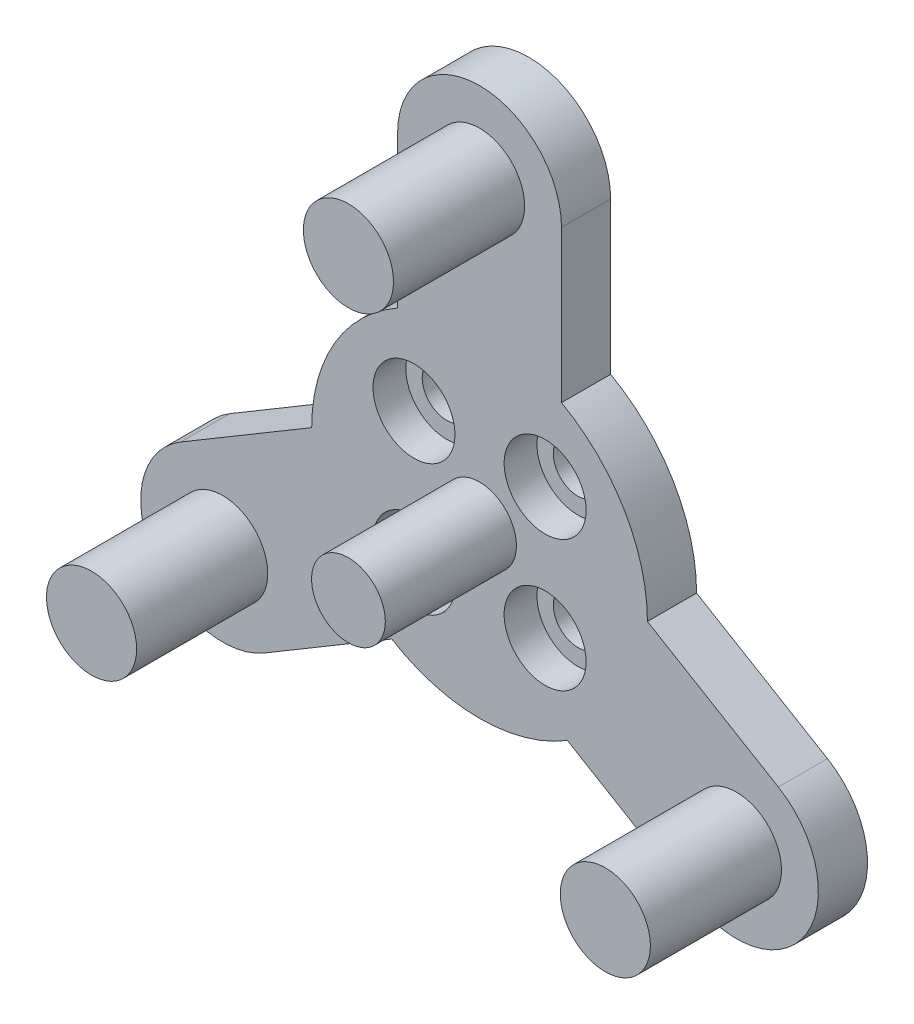
from build123d import *

# Parameters (mm, degrees)
SALIENTE_EXTRUIR1_DEPTH = 3
CROQUIS2_R              = 2.75
SALIENTE_EXTRUIR2_DEPTH = 8
CROQUIS3_R              = 2.25
SALIENTE_EXTRUIR3_DEPTH = 8
CORTAR_EXTRUIR1_DEPTH   = 10
CROQUIS5_R              = 2.5
CORTAR_EXTRUIR2_DEPTH   = 2


with BuildPart() as part:
    # Croquis1 → Saliente-Extruir1 (new body)
    with BuildSketch(Plane.XY):
        with BuildLine():
            Line((-13.118348224, -13.346885602), (-5.358962429, -8.729934305))
            ThreePointArc((-5.358962429, -8.729934305), (0, -10.243545836), (5.358962429, -8.729934305))
            Line((5.358962429, -8.729934305), (13.118348224, -13.346885602))
            ThreePointArc((13.118348224, -13.346885602), (19.97194541, -11.606711584), (18.231771393, -4.753114398))
            Line((18.231771393, -4.753114398), (10.243545836, 0))
            ThreePointArc((10.243545836, 0), (8.83594818, 5.182301714), (5, 8.94037087))
            Line((5, 8.94037087), (5, 18.2))
            ThreePointArc((5, 18.2), (0, 23.2), (-5, 18.2))
            Line((-5, 18.2), (-5, 8.94037087))
            ThreePointArc((-5, 8.94037087), (-8.83594818, 5.182301714), (-10.243545836, 0))
            Line((-10.243545836, 0), (-18.231771393, -4.753114398))
            ThreePointArc((-18.231771393, -4.753114398), (-19.97194541, -11.606711584), (-13.118348224, -13.346885602))
        make_face()
    extrude(amount=SALIENTE_EXTRUIR1_DEPTH)

    # Croquis2 → Saliente-Extruir2 (add)
    with BuildSketch(Plane.XY.offset(3)):
        with Locations((0, 18.2)):
            Circle(CROQUIS2_R)
        with Locations((15.675059808, -9.05)):
            Circle(CROQUIS2_R)
        with Locations((-15.675059808, -9.05)):
            Circle(CROQUIS2_R)
    extrude(amount=SALIENTE_EXTRUIR2_DEPTH)

    # Croquis3 → Saliente-Extruir3 (add)
    with BuildSketch(Plane.XY.offset(3)):
        Circle(CROQUIS3_R)
    extrude(amount=SALIENTE_EXTRUIR3_DEPTH)

    # Croquis4 → Cortar-Extruir1 (cut)
    with BuildSketch(Plane(origin=(0, 0, 0), x_dir=(-1, 0, 0), z_dir=(0, 0, -1))):
        with BuildLine():
            Line((-4, 2.5), (-4, 4))
            Line((-4, 4), (-2.5, 4))
            ThreePointArc((-2.5, 4), (-5.060660172, 5.060660172), (-4, 2.5))
        make_face()
        with BuildLine():
            Line((-2.5, 4), (-4, 4))
            Line((-4, 4), (-4, 2.5))
            ThreePointArc((-4, 2.5), (-2.939339828, 2.939339828), (-2.5, 4))
        make_face()
        with BuildLine():
            ThreePointArc((5.5, 4), (4, 5.5), (2.5, 4))
            Line((2.5, 4), (4, 4))
            Line((4, 4), (4, 2.5))
            ThreePointArc((4, 2.5), (5.060660172, 2.939339828), (5.5, 4))
        make_face()
        with BuildLine():
            Line((4, 4), (2.5, 4))
            ThreePointArc((2.5, 4), (2.939339828, 2.939339828), (4, 2.5))
            Line((4, 2.5), (4, 4))
        make_face()
        with BuildLine():
            ThreePointArc((5.5, -4), (5.060660172, -2.939339828), (4, -2.5))
            Line((4, -2.5), (4, -4))
            Line((4, -4), (2.5, -4))
            ThreePointArc((2.5, -4), (4, -5.5), (5.5, -4))
        make_face()
        with BuildLine():
            Line((4, -4), (4, -2.5))
            ThreePointArc((4, -2.5), (2.939339828, -2.939339828), (2.5, -4))
            Line((2.5, -4), (4, -4))
        make_face()
        with BuildLine():
            ThreePointArc((-2.5, -4), (-2.939339828, -2.939339828), (-4, -2.5))
            Line((-4, -2.5), (-4, -4))
            Line((-4, -4), (-2.5, -4))
        make_face()
        with BuildLine():
            Line((-4, -4), (-4, -2.5))
            ThreePointArc((-4, -2.5), (-5.060660172, -5.060660172), (-2.5, -4))
            Line((-2.5, -4), (-4, -4))
        make_face()
    extrude(amount=-CORTAR_EXTRUIR1_DEPTH, mode=Mode.SUBTRACT)

    # Croquis5 → Cortar-Extruir2 (cut)
    with BuildSketch(Plane.XY.offset(3)):
        with Locations((-4, 4)):
            Circle(CROQUIS5_R)
        with Locations((4, 4)):
            Circle(CROQUIS5_R)
        with Locations((4, -4)):
            Circle(CROQUIS5_R)
        with Locations((-4, -4)):
            Circle(CROQUIS5_R)
    extrude(amount=-CORTAR_EXTRUIR2_DEPTH, mode=Mode.SUBTRACT)


solid = part.part
